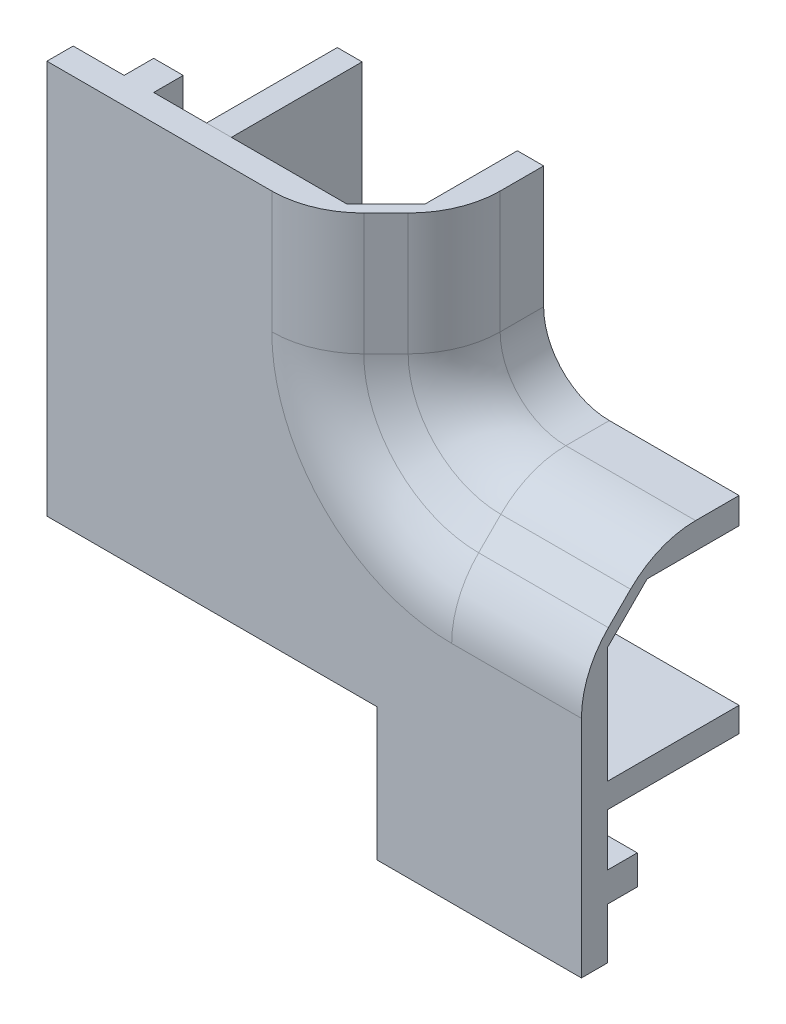
from build123d import *

# Parameters (mm, degrees)
EXTRUDE_1_DEPTH = 5
EXTRUDE_2_DEPTH = 20
EXTRUDE_3_DEPTH = 4
SKETCH_5_W      = 4.5
SKETCH_5_H      = 25.000557093
SKETCH_5_W_2    = 31.152641205
SKETCH_5_H_2    = 4.5
EXTRUDE_4_DEPTH = 4.5
EXTRUDE_5_DEPTH = 20
FILLET_1_R      = 10
CHAMFER_5_SIZE  = 6
CHAMFER_7_SIZE  = 11.58
FILLET_6_R      = 14


with BuildPart() as part:
    # 草圖1 → 填料-伸長1 (new body)
    with BuildSketch(Plane(origin=(0, 0, 0), x_dir=(1, 0, 0), z_dir=(0, 1, 0))):
        Polygon((-27.501723192, 6.859259259), (-23.001723192, 6.859259259), (-23.001723192, 2.359259259), (5.998276808, 2.359259259), (12.361610141, 2.359259259), (16.361610141, 2.359259259), (16.361610141, -1.640740741), (4.778276808, -1.640740741), (-35.251723192, -1.640740741), (-35.251723192, 2.359259259), (-27.501723192, 2.359259259), align=None)
    extrude(amount=EXTRUDE_1_DEPTH)

    # 草圖2 → 填料-伸長2 (add)
    with BuildSketch(Plane(origin=(0, 0, -2.359259259), x_dir=(-1, 0, 0), z_dir=(0, 0, -1))):
        Polygon((-18.062129234, -51.231786311), (-46.112129234, -51.231786311), (-46.112129234, -54.981786311), (-24.959488029, -54.981786311), (-14.959488029, -54.981786311), (-14.959488029, -49.981786311), (10.051723192, -25.000557093), (15.051723192, -25.000557093), (15.051723192, 4.899473368), (11.271723192, 4.899473368), (11.271723192, -23.150526632), (10.037259461, -23.166081548), align=None)
    extrude(amount=EXTRUDE_2_DEPTH)

    # 草圖4 → 填料-伸長3 (add)
    with BuildSketch(Plane.XY.offset(-2.359259259)):
        Polygon((-35.251723192, -54.981786311), (14.959488029, -54.981786311), (14.959488029, -75.181786311), (46.112129234, -75.181786311), (46.112129234, -23.571786311), (16.361610141, -23.571786311), (16.361610141, 0), (-35.251723192, 0), align=None)
    extrude(amount=EXTRUDE_3_DEPTH)

    # 草圖5 → 填料-伸長4 (add)
    with BuildSketch(Plane(origin=(0, 0, -2.359259259), x_dir=(-1, 0, 0), z_dir=(0, 0, -1))):
        with Locations((25.251723192, -12.500278547)):
            Rectangle(SKETCH_5_W, SKETCH_5_H)
        with Locations((-30.535808632, -65.181786311)):
            Rectangle(SKETCH_5_W_2, SKETCH_5_H_2)
    extrude(amount=EXTRUDE_4_DEPTH)

    # 草圖6 → 填料-伸長5 (add)
    with BuildSketch(Plane(origin=(0, 0, -2.359259259), x_dir=(-1, 0, 0), z_dir=(0, 0, -1))):
        Polygon((-16.361610141, 5), (-16.361610141, -23.571786311), (-46.112129234, -23.571786311), (-46.112129234, -27.571786311), (-12.361610141, -27.571786311), (-12.361610141, 5), align=None)
    extrude(amount=EXTRUDE_5_DEPTH)

    # 圓角1
    fillet_1_edges = [part.edges().sort_by_distance(p)[0] for p in [
        (16.361610141, -23.571786311, -10.359259259),
    ]]
    fillet(fillet_1_edges, radius=FILLET_1_R)

    # Chamfer 5
    chamfer_5_edges = [part.edges().sort_by_distance(p)[0] for p in [
        (29.236869688, -27.571786311, -2.359259259),
        (12.361610141, -11.285893155, -2.359259259),
    ]]
    chamfer(chamfer_5_edges, length=CHAMFER_5_SIZE)

    # 導角7
    chamfer_7_edges = [part.edges().sort_by_distance(p)[0] for p in [
        (19.290542329, -20.642854123, 1.640740741),
        (16.361610141, -4.285893155, 1.640740741),
        (36.236869688, -23.571786311, 1.640740741),
    ]]
    chamfer(chamfer_7_edges, length=CHAMFER_7_SIZE)

    # 圓角6
    fillet_6_edges = [part.edges().sort_by_distance(p)[0] for p in [
        (4.781610141, -4.285893155, 1.640740741),
        (11.102245803, -28.831150649, 1.640740741),
        (36.236869688, -35.151786311, 1.640740741),
        (36.236869688, -23.571786311, -9.939259259),
        (19.290542329, -20.642854123, -9.939259259),
        (16.361610141, -4.285893155, -9.939259259),
    ]]
    fillet(fillet_6_edges, radius=FILLET_6_R)


solid = part.part
